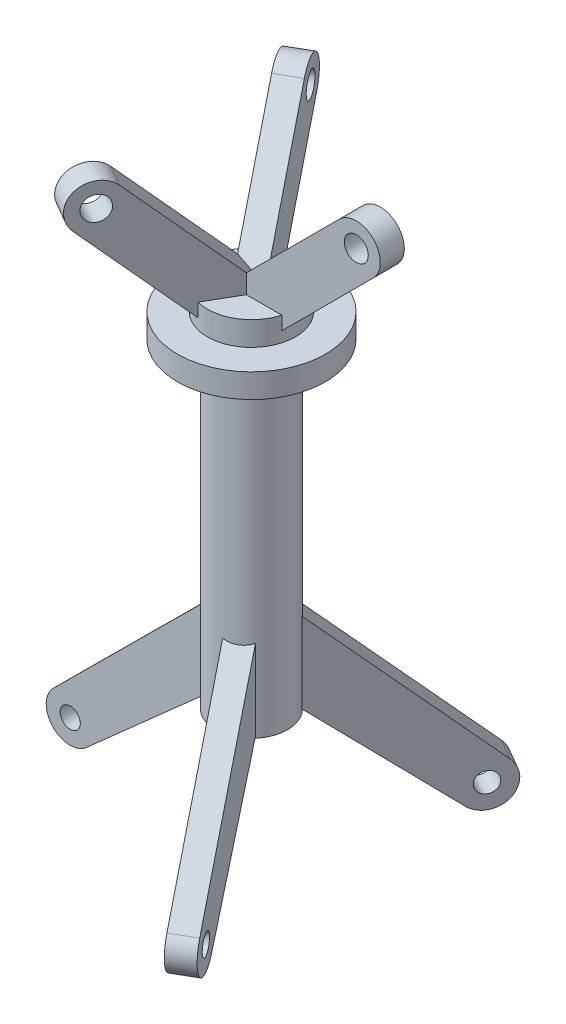
from build123d import *

# Parameters (mm, degrees)
SKETCH3_R           = 6.3
BOSS_EXTRUDE1_DEPTH = 7.5
CIRPATTERN2_COUNT   = 3
BOSS_EXTRUDE2_START = -15
SKETCH4_R           = 17.5
BOSS_EXTRUDE2_DEPTH = 15
SKETCH6_R           = 7.5
BOSS_EXTRUDE3_DEPTH = 7.5
CIRPATTERN3_COUNT   = 3
SKETCH7_R           = 27.5
BOSS_EXTRUDE4_DEPTH = 15


with BuildPart() as part:
    # Sketch2 → Revolve1 (revolve)
    with BuildSketch(Plane.XY, mode=Mode.PRIVATE) as revolve1_sk:
        Polygon((22.5, -107.5), (22.5, 92.5), (46.2, 92.5), (46.2, 107.5), (17.5, 107.5), (17.5, -107.5), align=None)
    revolve(revolve1_sk.sketch.rotate(Axis((0, 107.5, 0), (0, -1, 0)), 180), axis=Axis((0, 107.5, 0), (0, -1, 0)))

    # Sketch4 → Boss-Extrude2 (add)
    with BuildSketch(Plane(origin=(0, 107.5, 0), x_dir=(1, 0, 0), z_dir=(0, 1, 0)).offset(BOSS_EXTRUDE2_START)):
        with Locations(Location((0, 0, 0), (0, 0, 180))):
            Circle(SKETCH4_R)
    extrude(amount=BOSS_EXTRUDE2_DEPTH)

    # Sketch6 → Boss-Extrude3 (add, symmetric)
    with BuildSketch(Plane.XY):
        with BuildLine():
            Line((-21.465511899, 108.534488101), (62.352813742, 192.352813742))
            ThreePointArc((62.352813742, 192.352813742), (83.566017178, 192.352813742), (83.566017178, 171.139610307))
            Line((83.566017178, 171.139610307), (19.926406871, 107.5))
            Line((19.926406871, 107.5), (-22.5, 107.5))
            Line((-22.5, 107.5), (-21.465511899, 108.534488101))
        make_face()
        with Locations((72.95941546, 181.746212025)):
            Circle(SKETCH6_R, mode=Mode.SUBTRACT)
    extrude(amount=BOSS_EXTRUDE3_DEPTH, both=True)


with BuildPart() as body_2:
    # Sketch3 → Boss-Extrude1 (new, symmetric)
    with BuildSketch(Plane.XY):
        with BuildLine():
            Line((-95.722128186, -172.5), (-22.5, -107.5))
            Line((-22.5, -107.5), (-19.5, -105.560272822))
            Line((-19.5, -105.560272822), (-19.500000012, -57.5))
            Line((-19.500000012, -57.5), (-19.500000012, -54.519551263))
            Line((-19.500000012, -54.519551263), (-22.5, -57.5))
            Line((-22.5, -57.5), (-116.252065025, -150.641074971))
            ThreePointArc((-116.252065025, -150.641074971), (-116.613965447, -171.55130945), (-95.722128186, -172.5))
        make_face()
        with Locations((-105.680194847, -161.28229487)):
            Circle(SKETCH3_R, mode=Mode.SUBTRACT)
    extrude(amount=BOSS_EXTRUDE1_DEPTH, both=True)


with BuildPart() as cirpattern2_1:
    # CirPattern2: pattern copy
    add(body_2.part.rotate(Axis((0, 0, 0), (0, 1, 0)), 1 * 360 / CIRPATTERN2_COUNT))


with BuildPart() as cirpattern2_2:
    # CirPattern2: pattern copy
    add(body_2.part.rotate(Axis((0, 0, 0), (0, 1, 0)), 2 * 360 / CIRPATTERN2_COUNT))


with BuildPart() as cirpattern3_1:
    # CirPattern3: pattern copy
    add(part.part.rotate(Axis((0, 0, 0), (0, 1, 0)), 1 * 360 / CIRPATTERN3_COUNT))


with BuildPart() as cirpattern3_2:
    # CirPattern3: pattern copy
    add(part.part.rotate(Axis((0, 0, 0), (0, 1, 0)), 2 * 360 / CIRPATTERN3_COUNT))


with BuildPart() as part_1:
    add(part.part)

    add(cirpattern3_1.part)  # Boss-Extrude4 merges CirPattern3_1

    add(cirpattern3_2.part)  # Boss-Extrude4 merges CirPattern3_2
    # Sketch7 → Boss-Extrude4 (add)
    with BuildSketch(Plane(origin=(0, 107.5, 0), x_dir=(1, 0, 0), z_dir=(0, 1, 0))):
        Circle(SKETCH7_R)
    extrude(amount=BOSS_EXTRUDE4_DEPTH)


solid = Compound([body_2.part, cirpattern2_1.part, cirpattern2_2.part, part_1.part])
